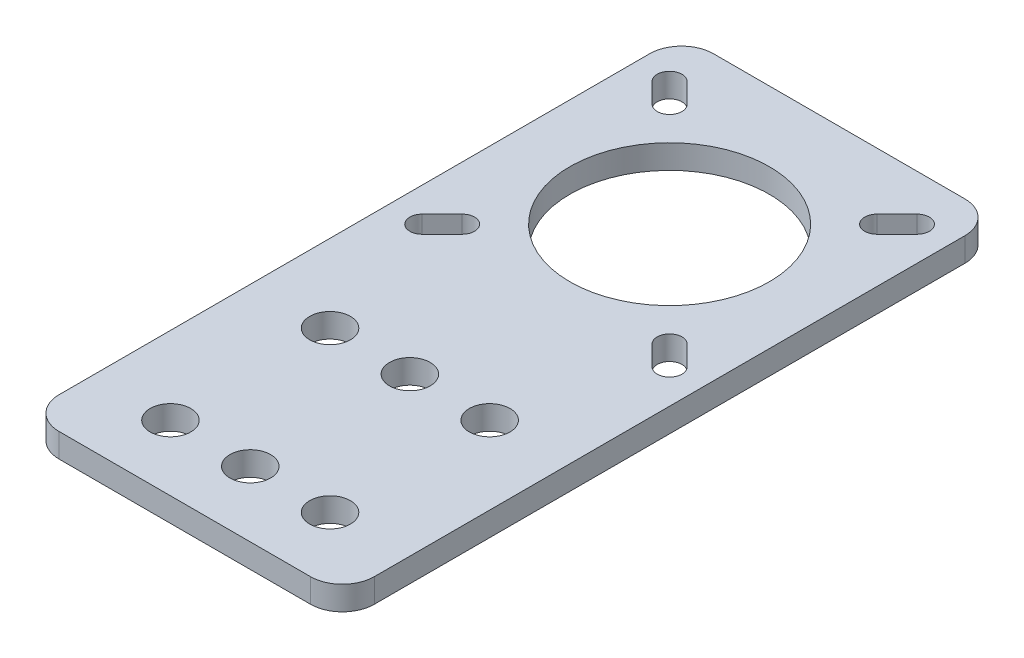
from build123d import *

# Parameters (mm, degrees)
SKETCH1_W           = 39.5
SKETCH1_H           = 82
BOSS_EXTRUDE1_DEPTH = 3
SKETCH2_R           = 12.5
SKETCH2_R_2         = 2.55
CUT_EXTRUDE1_DEPTH  = 46.6077022
FILLET1_R           = 4


with BuildPart() as part:
    # Sketch1 → Boss-Extrude1 (new body)
    with BuildSketch(Plane(origin=(0, 0, 0), x_dir=(1, 0, 0), z_dir=(0, 1, 0))):
        Rectangle(SKETCH1_W, SKETCH1_H)
    extrude(amount=BOSS_EXTRUDE1_DEPTH)

    # Sketch2 → Cut-Extrude1 (cut, through all)
    with BuildSketch(Plane(origin=(0, 3, 0), x_dir=(1, 0, 0), z_dir=(0, 1, 0))):
        with BuildLine():
            Line((-16.596015511, 5.346015511), (-15.5, 4.25))
            Line((-15.5, 4.25), (-14.403984489, 5.346015511))
            ThreePointArc((-14.403984489, 5.346015511), (-15.5, 5.8), (-16.596015511, 5.346015511))
        make_face()
        with BuildLine():
            Line((-14.403984489, 5.346015511), (-15.5, 4.25))
            Line((-15.5, 4.25), (-14.403984489, 3.153984489))
            ThreePointArc((-14.403984489, 3.153984489), (-14.067986725, 3.65684068), (-13.95, 4.25))
            ThreePointArc((-13.95, 4.25), (-14.067986725, 4.84315932), (-14.403984489, 5.346015511))
        make_face()
        with BuildLine():
            Line((-14.403984489, 3.153984489), (-15.5, 4.25))
            Line((-15.5, 4.25), (-16.596015511, 5.346015511))
            ThreePointArc((-16.596015511, 5.346015511), (-16.596015511, 3.153984489), (-14.403984489, 3.153984489))
        make_face()
        with BuildLine():
            ThreePointArc((-16.596015511, 5.346015511), (-15.5, 5.8), (-14.403984489, 5.346015511))
            Line((-14.403984489, 5.346015511), (-14.096015511, 5.653984489))
            ThreePointArc((-14.096015511, 5.653984489), (-14.55, 6.75), (-14.096015511, 7.846015511))
            Line((-14.096015511, 7.846015511), (-16.596015511, 5.346015511))
        make_face()
        with BuildLine():
            Line((-14.096015511, 5.653984489), (-14.403984489, 5.346015511))
            ThreePointArc((-14.403984489, 5.346015511), (-14.067986725, 4.84315932), (-13.95, 4.25))
            ThreePointArc((-13.95, 4.25), (-14.067986725, 3.65684068), (-14.403984489, 3.153984489))
            Line((-14.403984489, 3.153984489), (-11.903984489, 5.653984489))
            ThreePointArc((-11.903984489, 5.653984489), (-13, 5.2), (-14.096015511, 5.653984489))
        make_face()
        with BuildLine():
            ThreePointArc((-14.096015511, 7.846015511), (-14.55, 6.75), (-14.096015511, 5.653984489))
            Line((-14.096015511, 5.653984489), (-13, 6.75))
            Line((-13, 6.75), (-14.096015511, 7.846015511))
        make_face()
        with BuildLine():
            Line((-13, 6.75), (-14.096015511, 5.653984489))
            ThreePointArc((-14.096015511, 5.653984489), (-13, 5.2), (-11.903984489, 5.653984489))
            Line((-11.903984489, 5.653984489), (-13, 6.75))
        make_face()
        with BuildLine():
            Line((-13, 6.75), (-11.903984489, 5.653984489))
            ThreePointArc((-11.903984489, 5.653984489), (-11.567986725, 6.15684068), (-11.45, 6.75))
            ThreePointArc((-11.45, 6.75), (-12.40684068, 8.182013275), (-14.096015511, 7.846015511))
            Line((-14.096015511, 7.846015511), (-13, 6.75))
        make_face()
        with BuildLine():
            Line((-14.096015511, 31.653984489), (-13, 32.75))
            Line((-13, 32.75), (-11.903984489, 33.846015511))
            ThreePointArc((-11.903984489, 33.846015511), (-14.096015511, 33.846015511), (-14.096015511, 31.653984489))
        make_face()
        with BuildLine():
            Line((-11.903984489, 33.846015511), (-13, 32.75))
            Line((-13, 32.75), (-14.096015511, 31.653984489))
            ThreePointArc((-14.096015511, 31.653984489), (-12.40684068, 31.317986725), (-11.45, 32.75))
            ThreePointArc((-11.45, 32.75), (-11.567986725, 33.34315932), (-11.903984489, 33.846015511))
        make_face()
        with BuildLine():
            ThreePointArc((-14.096015511, 31.653984489), (-14.096015511, 33.846015511), (-11.903984489, 33.846015511))
            Line((-11.903984489, 33.846015511), (-14.403984489, 36.346015511))
            ThreePointArc((-14.403984489, 36.346015511), (-14.067986725, 35.84315932), (-13.95, 35.25))
            ThreePointArc((-13.95, 35.25), (-14.90684068, 33.817986725), (-16.596015511, 34.153984489))
            Line((-16.596015511, 34.153984489), (-14.096015511, 31.653984489))
        make_face()
        with BuildLine():
            ThreePointArc((-13.95, 35.25), (-14.067986725, 35.84315932), (-14.403984489, 36.346015511))
            Line((-14.403984489, 36.346015511), (-15.5, 35.25))
            Line((-15.5, 35.25), (-16.596015511, 34.153984489))
            ThreePointArc((-16.596015511, 34.153984489), (-14.90684068, 33.817986725), (-13.95, 35.25))
        make_face()
        with BuildLine():
            Line((-15.5, 35.25), (-14.403984489, 36.346015511))
            ThreePointArc((-14.403984489, 36.346015511), (-16.596015511, 36.346015511), (-16.596015511, 34.153984489))
            Line((-16.596015511, 34.153984489), (-15.5, 35.25))
        make_face()
        with BuildLine():
            Line((16.596015511, 34.153984489), (15.5, 35.25))
            Line((15.5, 35.25), (14.403984489, 36.346015511))
            ThreePointArc((14.403984489, 36.346015511), (14.403984489, 34.153984489), (16.596015511, 34.153984489))
        make_face()
        with BuildLine():
            Line((14.403984489, 36.346015511), (15.5, 35.25))
            Line((15.5, 35.25), (16.596015511, 34.153984489))
            ThreePointArc((16.596015511, 34.153984489), (16.932013275, 34.65684068), (17.05, 35.25))
            ThreePointArc((17.05, 35.25), (16.09315932, 36.682013275), (14.403984489, 36.346015511))
        make_face()
        with BuildLine():
            ThreePointArc((16.596015511, 34.153984489), (14.403984489, 34.153984489), (14.403984489, 36.346015511))
            Line((14.403984489, 36.346015511), (11.903984489, 33.846015511))
            ThreePointArc((11.903984489, 33.846015511), (13.59315932, 34.182013275), (14.55, 32.75))
            ThreePointArc((14.55, 32.75), (14.432013275, 32.15684068), (14.096015511, 31.653984489))
            Line((14.096015511, 31.653984489), (16.596015511, 34.153984489))
        make_face()
        with BuildLine():
            ThreePointArc((14.55, 32.75), (13.59315932, 34.182013275), (11.903984489, 33.846015511))
            Line((11.903984489, 33.846015511), (13, 32.75))
            Line((13, 32.75), (14.096015511, 31.653984489))
            ThreePointArc((14.096015511, 31.653984489), (14.432013275, 32.15684068), (14.55, 32.75))
        make_face()
        with BuildLine():
            Line((13, 32.75), (11.903984489, 33.846015511))
            ThreePointArc((11.903984489, 33.846015511), (11.903984489, 31.653984489), (14.096015511, 31.653984489))
            Line((14.096015511, 31.653984489), (13, 32.75))
        make_face()
        with BuildLine():
            ThreePointArc((14.403984489, 3.153984489), (14.403984489, 5.346015511), (16.596015511, 5.346015511))
            Line((16.596015511, 5.346015511), (14.096015511, 7.846015511))
            ThreePointArc((14.096015511, 7.846015511), (14.432013275, 7.34315932), (14.55, 6.75))
            ThreePointArc((14.55, 6.75), (13.59315932, 5.317986725), (11.903984489, 5.653984489))
            Line((11.903984489, 5.653984489), (14.403984489, 3.153984489))
        make_face()
        with BuildLine():
            ThreePointArc((17.05, 4.25), (16.932013275, 4.84315932), (16.596015511, 5.346015511))
            ThreePointArc((16.596015511, 5.346015511), (14.403984489, 5.346015511), (14.403984489, 3.153984489))
            ThreePointArc((14.403984489, 3.153984489), (16.09315932, 2.817986725), (17.05, 4.25))
        make_face()
        with BuildLine():
            ThreePointArc((14.55, 6.75), (14.432013275, 7.34315932), (14.096015511, 7.846015511))
            ThreePointArc((14.096015511, 7.846015511), (11.903984489, 7.846015511), (11.903984489, 5.653984489))
            ThreePointArc((11.903984489, 5.653984489), (13.59315932, 5.317986725), (14.55, 6.75))
        make_face()
        with Locations(Location((0, 19.75, 0), (0, 0, 270))):
            Circle(SKETCH2_R)
        with Locations(Location((0, -32.8, 0), (0, 0, 270))):
            Circle(SKETCH2_R_2)
        with Locations(Location((0, -12.8, 0), (0, 0, 270))):
            Circle(SKETCH2_R_2)
        with Locations(Location((-10, -12.8, 0), (0, 0, 270))):
            Circle(SKETCH2_R_2)
        with Locations(Location((-10, -32.8, 0), (0, 0, 270))):
            Circle(SKETCH2_R_2)
        with Locations(Location((10, -32.8, 0), (0, 0, 270))):
            Circle(SKETCH2_R_2)
        with Locations(Location((10, -12.8, 0), (0, 0, 270))):
            Circle(SKETCH2_R_2)
    extrude(amount=-CUT_EXTRUDE1_DEPTH, mode=Mode.SUBTRACT)

    # Fillet1
    fillet1_edges = [part.edges().sort_by_distance(p)[0] for p in [
        (19.75, 1.5, 41),
        (-19.75, 1.5, 41),
        (-19.75, 1.5, -41),
        (19.75, 1.5, -41),
    ]]
    fillet(fillet1_edges, radius=FILLET1_R)


solid = part.part
